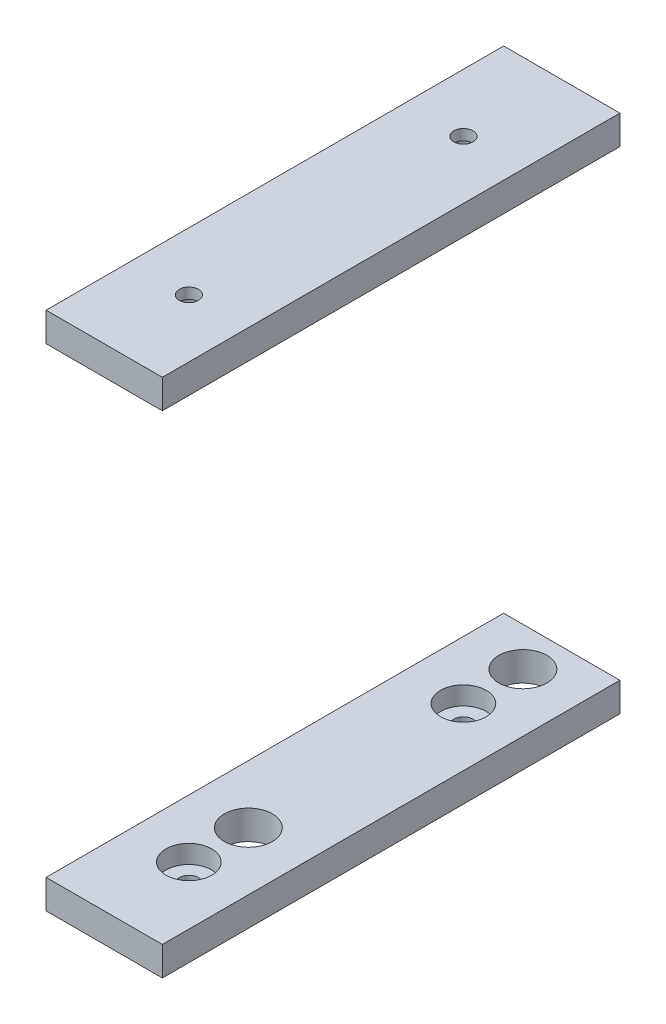
from build123d import *

# Parameters (mm, degrees)
SKETCH9_W                                          = 25.4
SKETCH9_H                                          = 100
BOSS_EXTRUDE2_DEPTH                                = 6.35
F_10_5_10_5_DIAMETER_HOLE2_D                       = 10.5
CBORE_FOR_M3_5_HEX_HEAD_MACHINE_SCREW2_D           = 4.2
CBORE_FOR_M3_5_HEX_HEAD_MACHINE_SCREW2_CBORE_D     = 10
CBORE_FOR_M3_5_HEX_HEAD_MACHINE_SCREW2_CBORE_DEPTH = 4
SKETCH16_W                                         = 25.4
SKETCH16_H                                         = 100
BOSS_EXTRUDE3_DEPTH                                = 6.35
CBORE_FOR_M3_5_HEX_HEAD_MACHINE_SCREW3_A_COUNT     = 2
CBORE_FOR_M3_5_HEX_HEAD_MACHINE_SCREW3_A_PITCH     = 60


with BuildPart() as part:
    # Sketch9 → Boss-Extrude2 (new body)
    with BuildSketch(Plane(origin=(0, -113.7, 0), x_dir=(-1, 0, 0), z_dir=(0, -1, 0))):
        with Locations((-91.475, 65)):
            Rectangle(SKETCH9_W, SKETCH9_H)
    extrude(amount=-BOSS_EXTRUDE2_DEPTH)

    # Ø10.5 (10.5) Diameter Hole2 (through all)
    with Locations(Plane(origin=(0, -113.7, 0), x_dir=(-1, 0, 0), z_dir=(0, -1, 0))):
        with Locations((-91.475, 106.5), (-91.475, 46.5)):
            Hole(F_10_5_10_5_DIAMETER_HOLE2_D / 2)

    # CBORE for M3.5 Hex Head Machine Screw2 (through all)
    with Locations(Plane(origin=(0, -107.35, 0), x_dir=(1, 0, 0), z_dir=(0, 1, 0))):
        with Locations((91.475, 33.5), (91.475, 93.5)):
            CounterBoreHole(CBORE_FOR_M3_5_HEX_HEAD_MACHINE_SCREW2_D / 2, CBORE_FOR_M3_5_HEX_HEAD_MACHINE_SCREW2_CBORE_D / 2, CBORE_FOR_M3_5_HEX_HEAD_MACHINE_SCREW2_CBORE_DEPTH)


with BuildPart() as body_2:
    # Sketch16 → Boss-Extrude3 (new body)
    with BuildSketch(Plane(origin=(0, 0, 0), x_dir=(1, 0, 0), z_dir=(0, 1, 0))):
        with Locations((91.475, 65)):
            Rectangle(SKETCH16_W, SKETCH16_H)
    extrude(amount=-BOSS_EXTRUDE3_DEPTH)

    # Sketch17 → CBORE for M3.5 Hex Head Machine Screw3 (revolve, cut)
    with BuildSketch(Plane(origin=(91.475, -6.35, -33.5), x_dir=(0, 0, -1), z_dir=(1, 0, 0))):
        Polygon((0, 0), (0, 9.525), (2.1, 9.525), (2.1, 4), (5, 4), (5, 0), align=None)
    cbore_for_m3_5_hex_head_machine_screw3 = revolve(axis=Axis((91.475, -12.7, -33.5), (0, 1, 0)), mode=Mode.SUBTRACT)

    # CBORE for M3.5 Hex Head Machine Screw3 a: CBORE for M3.5 Hex Head Machine Screw3 ×2
    with Locations(*[(0, 0, -i * CBORE_FOR_M3_5_HEX_HEAD_MACHINE_SCREW3_A_PITCH) for i in range(1, CBORE_FOR_M3_5_HEX_HEAD_MACHINE_SCREW3_A_COUNT)]):
        add(cbore_for_m3_5_hex_head_machine_screw3, mode=Mode.SUBTRACT)


solid = Compound([part.part, body_2.part])
